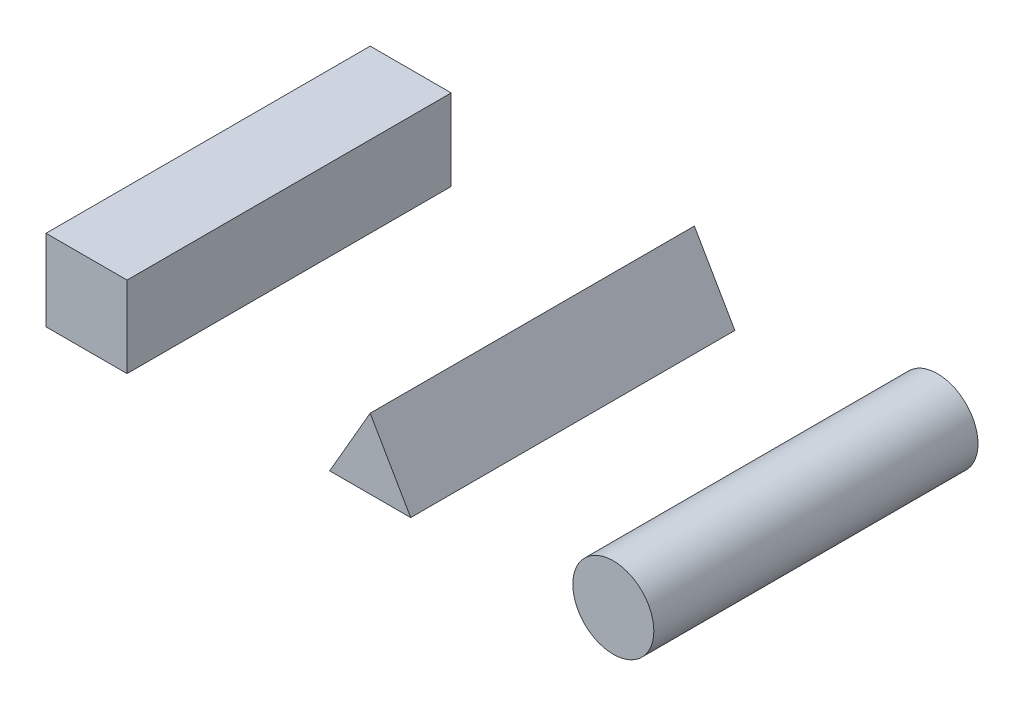
from build123d import *

# Parameters (mm, degrees)
SKETCH1_R             = 10
BOSS_EXTRUDE1_DEPTH   = 80
BOSS_EXTRUDE1_2_DEPTH = 80
SKETCH1_W             = 20
SKETCH1_H             = 20
BOSS_EXTRUDE1_3_DEPTH = 80


with BuildPart() as part:
    # Sketch1 → Boss-Extrude1 (new body)
    with BuildSketch(Plane.XY):
        with Locations((60, 0)):
            Circle(SKETCH1_R)
    extrude(amount=BOSS_EXTRUDE1_DEPTH)


with BuildPart() as body_2:
    # Sketch1 → Boss-Extrude1 2 (new body)
    with BuildSketch(Plane.XY):
        Polygon((-10, -5.773502692), (0, 11.547005384), (10, -5.773502692), align=None)
    extrude(amount=BOSS_EXTRUDE1_2_DEPTH)


with BuildPart() as body_3:
    # Sketch1 → Boss-Extrude1 3 (new body)
    with BuildSketch(Plane.XY):
        with Locations((-70, 0)):
            Rectangle(SKETCH1_W, SKETCH1_H)
    extrude(amount=BOSS_EXTRUDE1_3_DEPTH)


solid = Compound([part.part, body_2.part, body_3.part])
